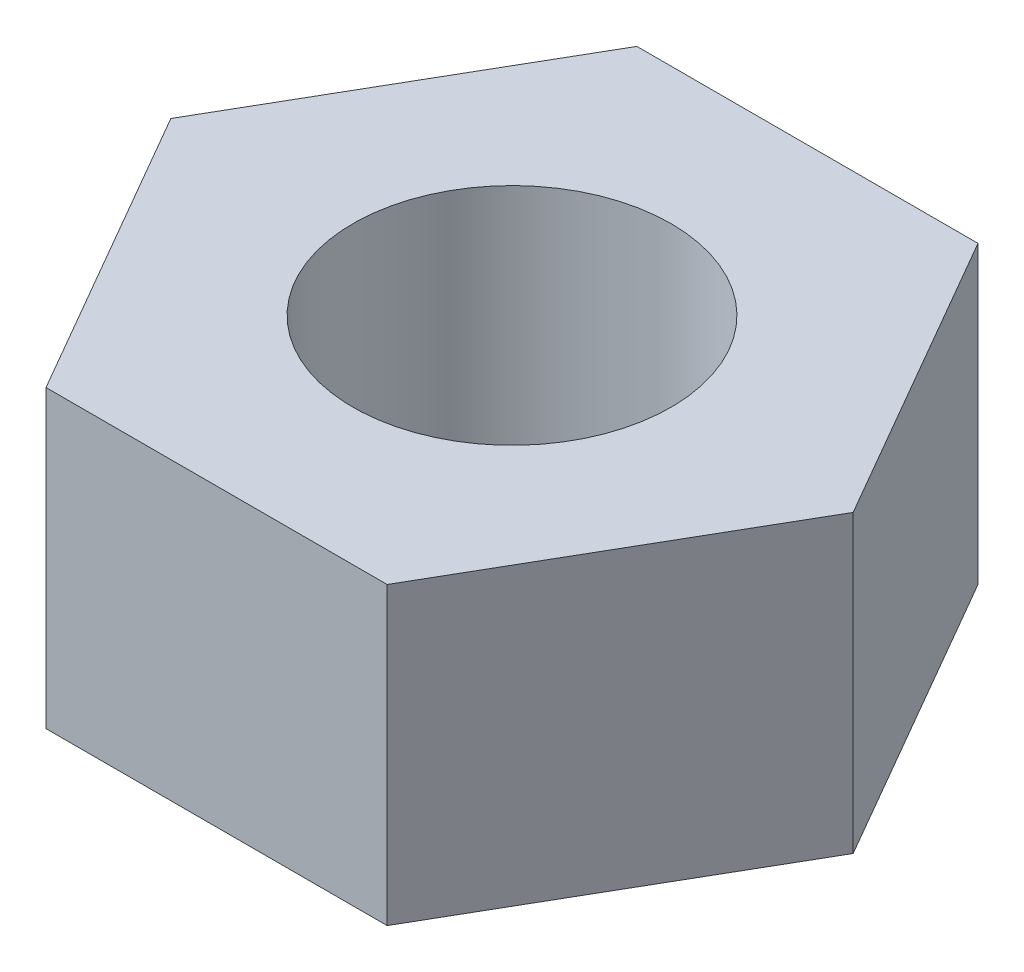
from build123d import *

# Parameters (mm, degrees)
SKETCH1_R           = 3.5
BOSS_EXTRUDE1_DEPTH = 6.5


with BuildPart() as part:
    # Sketch1 → Boss-Extrude1 (new body)
    with BuildSketch(Plane(origin=(0, 0, 0), x_dir=(1, 0, 0), z_dir=(0, 1, 0))):
        Polygon((3.75277675, 6.5), (-3.75277675, 6.5), (-7.505553499, 0), (-3.75277675, -6.5), (3.75277675, -6.5), (7.505553499, 0), align=None)
        with Locations(Location((0, 0, 0), (0, 0, 90))):
            Circle(SKETCH1_R, mode=Mode.SUBTRACT)
    extrude(amount=BOSS_EXTRUDE1_DEPTH)


solid = part.part
